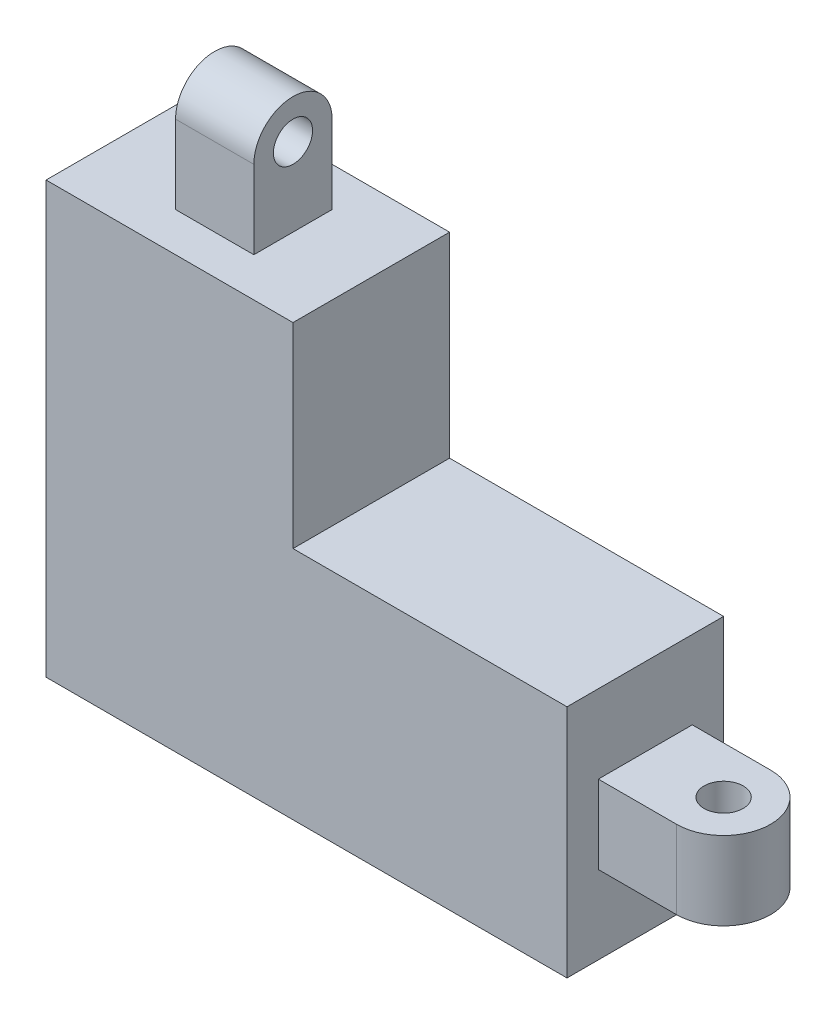
from build123d import *

# Parameters (mm, degrees)
SKETCH1_W           = 50
SKETCH1_H           = 40
BOSS_EXTRUDE1_DEPTH = 10
SKETCH5_W           = 6
SKETCH5_H           = 5
BOSS_EXTRUDE3_DEPTH = 10
SKETCH6_R           = 2
CUT_EXTRUDE1_DEPTH  = 20
SKETCH8_W           = 10
SKETCH8_H           = 40
CUT_EXTRUDE2_DEPTH  = 25
SKETCH9_W           = 10
SKETCH9_H           = 6
SKETCH9_R           = 1.25
BOSS_EXTRUDE4_DEPTH = 5
SKETCH10_W          = 10
SKETCH10_H          = 5
CUT_EXTRUDE3_DEPTH  = 15
SKETCH11_W          = 5
SKETCH11_H          = 5
BOSS_EXTRUDE5_DEPTH = 10
SKETCH12_R          = 1.25
CUT_EXTRUDE4_DEPTH  = 10
CUT_EXTRUDE5_DEPTH  = 10
CUT_EXTRUDE6_DEPTH  = 10
SCALE1_SCALE        = 2
SKETCH15_W          = 33.464905159
SKETCH15_H          = 55
SKETCH15_W_2        = 35
SKETCH15_H_2        = 25
CUT_EXTRUDE7_DEPTH  = 30


with BuildPart() as part:
    # Sketch1 → Boss-Extrude1 (new body)
    with BuildSketch(Plane(origin=(669.84184187, 0, 0), x_dir=(1, 0, 0), z_dir=(0, 0, 1))):
        with Locations((-671.310344828, 437.637931034)):
            Rectangle(SKETCH1_W, SKETCH1_H)
    boss_extrude1 = extrude(amount=BOSS_EXTRUDE1_DEPTH)

    # Sketch5 → Boss-Extrude3 (add)
    with BuildSketch(Plane(origin=(23.531497042, 0, 0), x_dir=(0, 0, -1), z_dir=(1, 0, 0))):
        with Locations((-5, 442.637931034)):
            Rectangle(SKETCH5_W, SKETCH5_H)
        with Locations((-5, 432.637931034)):
            Rectangle(SKETCH5_W, SKETCH5_H)
    extrude(amount=BOSS_EXTRUDE3_DEPTH)

    # Sketch6 → Cut-Extrude1 (cut)
    with BuildSketch(Plane(origin=(669.84184187, 445.137931034, 0), x_dir=(1, 0, 0), z_dir=(0, 1, 0))):
        with Locations(Location((-641.310344828, -5, 0), (0, 0, 180))):
            Circle(SKETCH6_R)
    extrude(amount=-CUT_EXTRUDE1_DEPTH, mode=Mode.SUBTRACT)

    # Sketch8 → Cut-Extrude2 (cut)
    with BuildSketch(Plane.ZY.offset(26.468502958)):
        with Locations((5, 437.637931034)):
            Rectangle(SKETCH8_W, SKETCH8_H)
    extrude(amount=-CUT_EXTRUDE2_DEPTH, mode=Mode.SUBTRACT)

    # Sketch9 → Boss-Extrude4 (add)
    with BuildSketch(Plane(origin=(0, 435.137931034, 0), x_dir=(1, 0, 0), z_dir=(0, 1, 0))):
        with Locations((28.531497042, -5)):
            Rectangle(SKETCH9_W, SKETCH9_H)
        with Locations(Location((28.531497042, -5, 0), (0, 0, 180))):
            Circle(SKETCH9_R, mode=Mode.SUBTRACT)
    extrude(amount=BOSS_EXTRUDE4_DEPTH)

    # Sketch10 → Cut-Extrude3 (cut)
    with BuildSketch(Plane.XY.offset(8)):
        with Locations((28.531497042, 432.637931034)):
            Rectangle(SKETCH10_W, SKETCH10_H)
        with Locations((28.531497042, 442.637931034)):
            Rectangle(SKETCH10_W, SKETCH10_H)
    extrude(amount=-CUT_EXTRUDE3_DEPTH, mode=Mode.SUBTRACT)

    # Mirror1: Boss-Extrude1 across plane
    add(boss_extrude1.mirror(Plane(origin=(-1.468502958, 0, 0), x_dir=(0, 0, 1), z_dir=(1, 0, 0))))

    # Sketch11 → Boss-Extrude5 (add)
    with BuildSketch(Plane(origin=(0, 457.637931034, 0), x_dir=(1, 0, 0), z_dir=(0, 1, 0))):
        with Locations((-1.468502958, -5)):
            Rectangle(SKETCH11_W, SKETCH11_H)
    extrude(amount=BOSS_EXTRUDE5_DEPTH)

    # Sketch12 → Cut-Extrude4 (cut)
    with BuildSketch(Plane(origin=(1.031497042, 0, 0), x_dir=(0, 0, -1), z_dir=(1, 0, 0))):
        with Locations((-5, 462.637931034)):
            Circle(SKETCH12_R)
    extrude(amount=-CUT_EXTRUDE4_DEPTH, mode=Mode.SUBTRACT)

    # Sketch13 → Cut-Extrude5 (cut)
    with BuildSketch(Plane(origin=(1.031497042, 0, 0), x_dir=(0, 0, -1), z_dir=(1, 0, 0))):
        with BuildLine():
            Line((-7.5, 467.637931034), (-7.5, 462.637931034))
            ThreePointArc((-7.5, 462.637931034), (-5, 465.137931034), (-2.5, 462.637931034))
            Line((-2.5, 462.637931034), (-2.5, 467.637931034))
            Line((-2.5, 467.637931034), (-7.5, 467.637931034))
        make_face()
    extrude(amount=-CUT_EXTRUDE5_DEPTH, mode=Mode.SUBTRACT)

    # Sketch14 → Cut-Extrude6 (cut)
    with BuildSketch(Plane(origin=(0, 440.137931034, 0), x_dir=(1, 0, 0), z_dir=(0, 1, 0))):
        with BuildLine():
            Line((33.531497042, -2), (28.531497042, -2))
            ThreePointArc((28.531497042, -2), (30.652817386, -2.878679656), (31.531497042, -5))
            ThreePointArc((31.531497042, -5), (30.652817386, -7.121320344), (28.531497042, -8))
            Line((28.531497042, -8), (33.531497042, -8))
            Line((33.531497042, -8), (33.531497042, -2))
        make_face()
    extrude(amount=-CUT_EXTRUDE6_DEPTH, mode=Mode.SUBTRACT)


with BuildPart() as part_1:
    # Scale1: scaled about (-1.193296494, 437.808884999, 5)
    add(part.part.scale(SCALE1_SCALE).moved(Location((1.193296494, -437.808884999, -5))))

    # Sketch15 → Cut-Extrude7 (cut)
    with BuildSketch(Plane.XY.offset(15)):
        with Locations((-35.011256843, 449.96697707)):
            Rectangle(SKETCH15_W, SKETCH15_H)
        Polygon((-51.743709422, 422.46697707), (-51.743709422, 397.46697707), (48.256290578, 397.46697707), (48.256290578, 422.46697707), (-18.278804263, 422.46697707), align=None)
        with Locations((30.756290578, 464.96697707)):
            Rectangle(SKETCH15_W_2, SKETCH15_H_2)
    extrude(amount=-CUT_EXTRUDE7_DEPTH, mode=Mode.SUBTRACT)


solid = part_1.part
